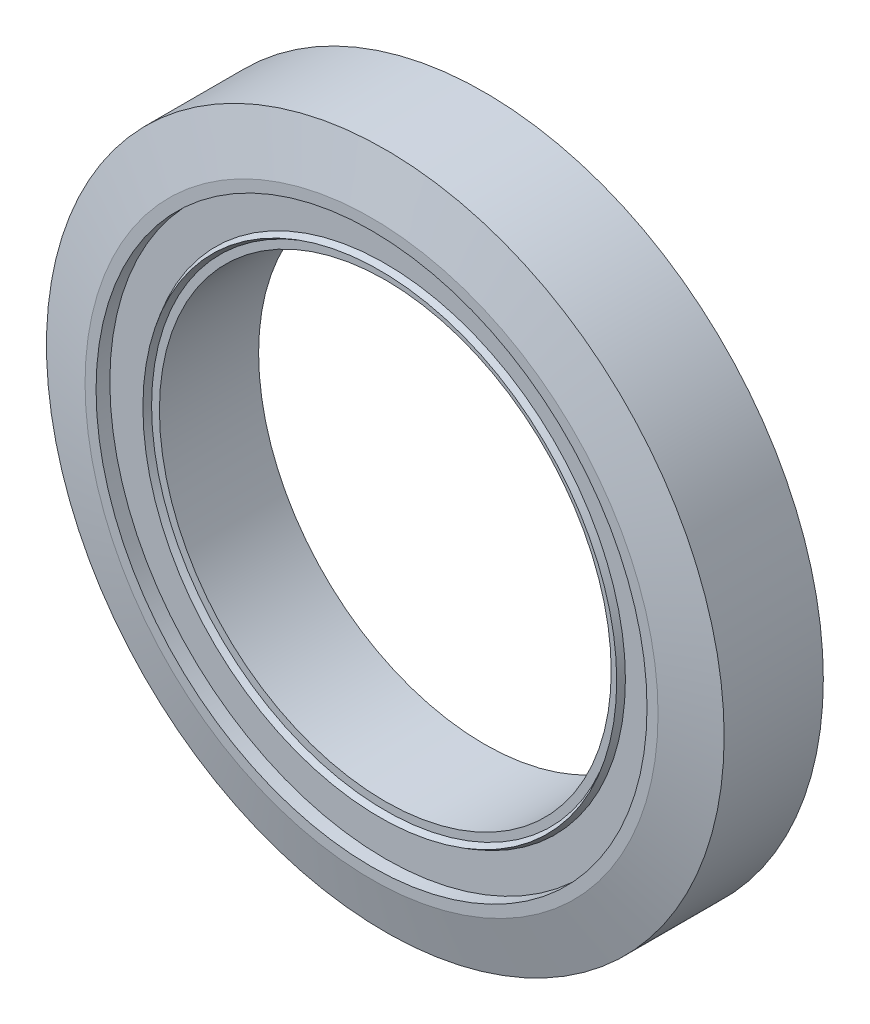
from build123d import *


with BuildPart() as part:
    # Sketch2 → Revolve2 (revolve)
    with BuildSketch(Plane(origin=(0, 0, 0), x_dir=(0, 0, -1), z_dir=(1, 0, 0)), mode=Mode.PRIVATE) as revolve2_sk:
        Polygon((-0.9, 6.15), (0.9, 6.15), (1.15, 5.2), (1.15, 5), (0.9, 5), (0.9, 4.357735027), (1, 4.3), (0.9, 4.242264973), (0.9, 4.1), (-0.9, 4.1), (-0.9, 4.242264973), (-1, 4.3), (-0.9, 4.357735027), (-0.9, 5), (-1.15, 5), (-1.15, 5.2), align=None)
    revolve(revolve2_sk.sketch.rotate(Axis((0, 0, 0), (0, 0, -1)), 90), axis=Axis((0, 0, 0), (0, 0, -1)))


solid = part.part
